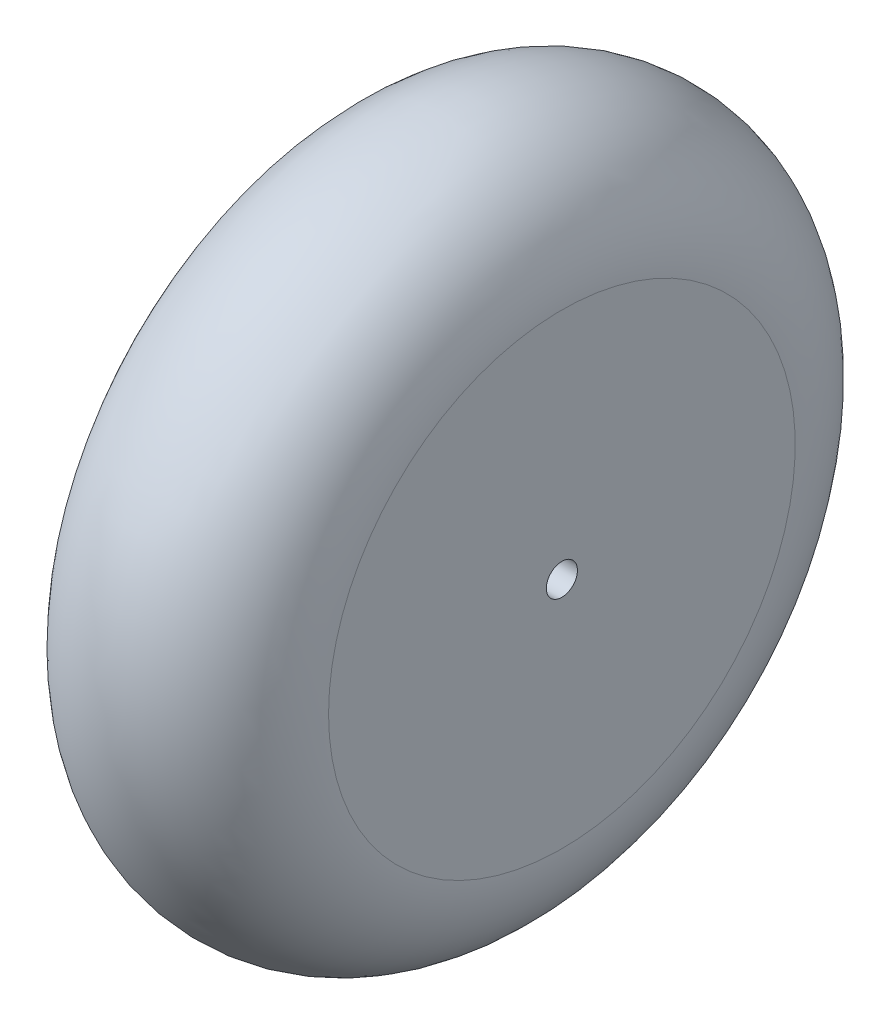
from build123d import *

# Parameters (mm, degrees)
SKETCH2_R          = 2
CUT_EXTRUDE1_DEPTH = 71.356236525


with BuildPart() as part:
    # Sketch1 → Revolve1 (revolve)
    with BuildSketch(Plane.XY, mode=Mode.PRIVATE) as revolve1_sk:
        with BuildLine():
            Line((0, 0), (30, 0))
            Line((30, 0), (30, 30))
            ThreePointArc((30, 30), (15, 45), (0, 30))
            Line((0, 30), (0, 0))
        make_face()
    revolve(revolve1_sk.sketch.rotate(Axis((0, 0, 0), (1, 0, 0)), 90), axis=Axis((0, 0, 0), (1, 0, 0)))

    # Sketch2 → Cut-Extrude1 (cut, through all)
    with BuildSketch(Plane(origin=(30, 0, 0), x_dir=(0, 0, -1), z_dir=(1, 0, 0))):
        Circle(SKETCH2_R)
    extrude(amount=-CUT_EXTRUDE1_DEPTH, mode=Mode.SUBTRACT)


solid = part.part
